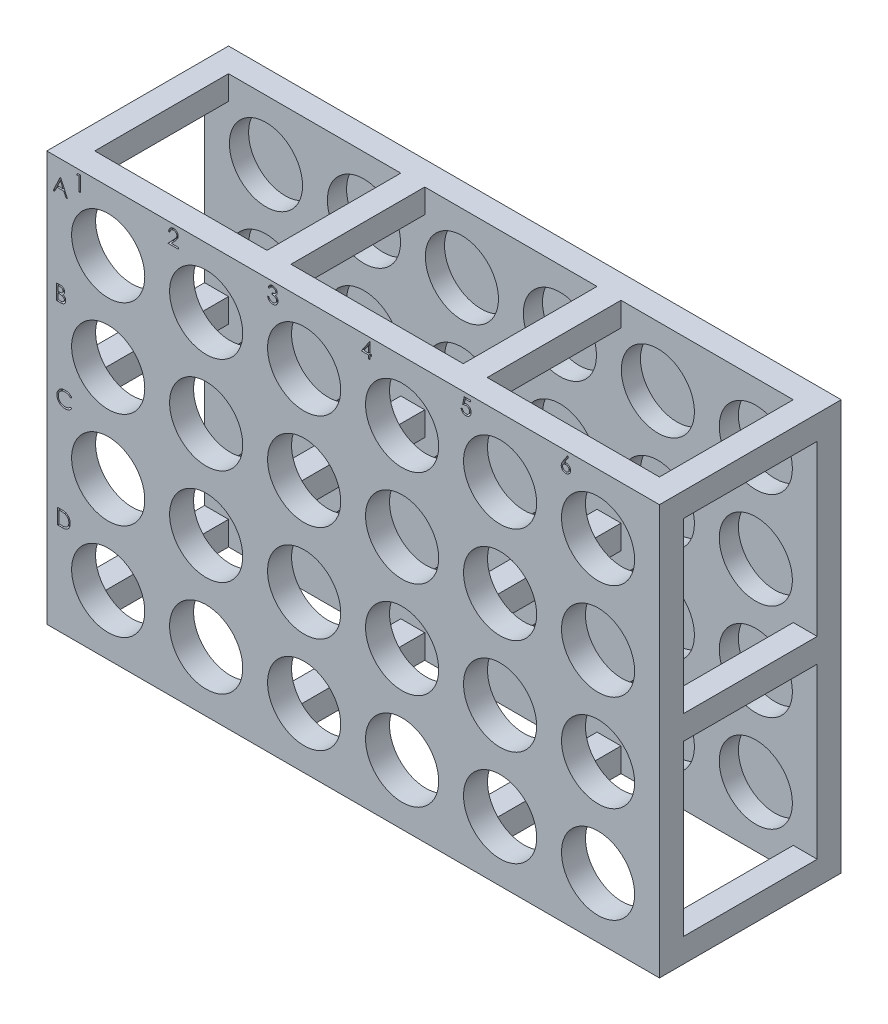
from build123d import *

# Parameters (mm, degrees)
SKETCH1_W            = 127.76
SKETCH1_H            = 85.48
BOSS_EXTRUDE1_DEPTH  = 5
SKETCH2_R            = 7.625
CUT_EXTRUDE1_DEPTH   = 95.825210988
SKETCH3_W            = 5
SKETCH3_H            = 5
BOSS_EXTRUDE2_DEPTH  = 13.95
LPATTERN2_COUNT      = 6
LPATTERN2_PITCH      = 20.43
LPATTERN2_COUNT_DIR2 = 4
LPATTERN2_PITCH_DIR2 = 20.146
LPATTERN5_COUNT      = 4
LPATTERN5_PITCH      = 40.92
LPATTERN5_COUNT_DIR2 = 3
LPATTERN5_PITCH_DIR2 = 40.24
CUT_EXTRUDE2_DEPTH   = 1
SKETCH6_W            = 127.76
SKETCH6_H            = 85.48
BOSS_EXTRUDE3_DEPTH  = 1


with BuildPart() as part:
    # Sketch1 → Boss-Extrude1 (new body)
    with BuildSketch(Plane.XY):
        with Locations((9.206235294, -17.469823529)):
            Rectangle(SKETCH1_W, SKETCH1_H)
    extrude(amount=BOSS_EXTRUDE1_DEPTH)

    # Sketch2 → Cut-Extrude1 (cut, through all)
    with BuildSketch(Plane.XY.offset(5)):
        with Locations((-41.868764706, 12.749176471)):
            Circle(SKETCH2_R)
    cut_extrude1 = extrude(amount=-CUT_EXTRUDE1_DEPTH, mode=Mode.SUBTRACT)

    # Sketch3 → Boss-Extrude2 (add)
    with BuildSketch(Plane.XY.offset(5)):
        with Locations((-52.173764706, 22.770176471)):
            Rectangle(SKETCH3_W, SKETCH3_H)
    boss_extrude2 = extrude(amount=BOSS_EXTRUDE2_DEPTH)

    # LPattern2: Cut-Extrude1 6 × 4
    with Locations(*[(i * LPATTERN2_PITCH, -j * LPATTERN2_PITCH_DIR2, 0) for i in range(LPATTERN2_COUNT) for j in range(LPATTERN2_COUNT_DIR2) if (i, j) != (0, 0)]):
        add(cut_extrude1, mode=Mode.SUBTRACT)

    # LPattern5: Boss-Extrude2 4 × 3
    with Locations(*[(i * LPATTERN5_PITCH, -j * LPATTERN5_PITCH_DIR2, 0) for i in range(LPATTERN5_COUNT) for j in range(LPATTERN5_COUNT_DIR2) if (i, j) != (0, 0)]):
        add(boss_extrude2)

    # Mirror9: part across plane


with BuildPart() as part_1:
    add(part.part)
    add(part.part.mirror(Plane(origin=(0, 0, 18.95), x_dir=(1, 0, 0), z_dir=(0, 0, -1))))

    # Sketch5 → Cut-Extrude2 (cut)
    # profile 1 of 10: a face of its own
    with BuildSketch(Plane.XY.offset(37.9)):
        Polygon((-51.807746166, 21.94980685), (-50.342361551, 18.77480685), (-50.652102136, 18.77480685), (-51.121483145, 19.792435055), (-52.560791038, 19.792435055), (-53.043528418, 18.77480685), (-53.354541038, 18.77480685), (-51.848451294, 21.94980685), align=None)
        Polygon((-51.831278818, 21.330961697), (-52.406238754, 20.11807608), (-51.271583306, 20.11807608), align=None, mode=Mode.SUBTRACT)
    # profile 2 of 10: a face of its own
    with BuildSketch(Plane.XY.offset(37.9)):
        with BuildLine():
            Line((-52.596136472, 2.460659233), (-51.976655302, 2.460659233))
            add(Edge.make_bspline(
                [(-51.976655302, 2.460659233), (-51.946330897, 2.460499802), (-51.887554653, 2.460190786), (-51.802084159, 2.455398231), (-51.722029881, 2.448863473), (-51.647368602, 2.438494746), (-51.578134822, 2.425983634), (-51.514119894, 2.410832701), (-51.45552738, 2.392665702), (-51.385575112, 2.363776575), (-51.305818513, 2.320847701), (-51.219459971, 2.257412503), (-51.145614696, 2.17982234), (-51.08194568, 2.092298788), (-51.031326093, 1.996018481), (-50.994705373, 1.893276216), (-50.971520729, 1.785397208), (-50.969136364, 1.711335182), (-50.967931344, 1.673905427)],
                knots=[0, 0, 0, 0, 1.001505555, 1.941167018, 2.826882275, 3.653841531, 4.429895133, 5.150066043, 5.825578002, 6.45369114, 7.647487171, 8.808567382, 9.977351308, 11.170798116, 12.373658725, 13.556498008, 14.765093433, 16, 16, 16, 16], degree=3))
            add(Edge.make_bspline(
                [(-50.967931344, 1.673905427), (-50.968923049, 1.638842037), (-50.970871844, 1.569939169), (-50.989507061, 1.469160942), (-51.018681382, 1.373229479), (-51.059235429, 1.282494886), (-51.11194224, 1.199007252), (-51.174406572, 1.122093089), (-51.2497691, 1.055008916), (-51.306232611, 1.017504997), (-51.334913516, 0.998454706)],
                knots=[0, 0, 0, 0, 1.044552857, 2.05264487, 3.044412934, 4.028983338, 5.005914585, 5.980388656, 6.974128949, 8, 8, 8, 8], degree=3))
            add(Edge.make_bspline(
                [(-51.334913516, 0.998454706), (-51.298845128, 0.984607171), (-51.229837367, 0.958113407), (-51.134872198, 0.911272664), (-51.053052589, 0.860325607), (-50.983749464, 0.804688857), (-50.924478877, 0.744718722), (-50.872723708, 0.679535868), (-50.828562747, 0.608289995), (-50.790723167, 0.531723931), (-50.761196795, 0.450619491), (-50.739084368, 0.36573743), (-50.726413896, 0.277382119), (-50.724610821, 0.217251811), (-50.723700575, 0.186896212)],
                knots=[0, 0, 0, 0, 1.27268992, 2.434971085, 3.483601985, 4.442670788, 5.356604649, 6.2567628, 7.179492994, 8.113709626, 9.066344395, 10.018646069, 10.999752585, 12, 12, 12, 12], degree=3))
            add(Edge.make_bspline(
                [(-50.723700575, 0.186896212), (-50.724586714, 0.155901978), (-50.726330217, 0.094919954), (-50.739193477, 0.005334939), (-50.760973167, -0.080276619), (-50.790973421, -0.162468464), (-50.830127806, -0.241081586), (-50.877778174, -0.316205047), (-50.93459395, -0.387084046), (-50.998150981, -0.45450619), (-51.07005307, -0.51512854), (-51.147628076, -0.569117788), (-51.231852952, -0.613518859), (-51.321344404, -0.650816964), (-51.417106319, -0.67930778), (-51.518708684, -0.699240043), (-51.626063872, -0.712670327), (-51.699732718, -0.713774506), (-51.737512674, -0.714340767)],
                knots=[0, 0, 0, 0, 0.978564426, 1.925352924, 2.850884081, 3.763762016, 4.682927383, 5.618979971, 6.567305752, 7.547517671, 8.540179244, 9.531824382, 10.526200242, 11.540722885, 12.589160233, 13.674978461, 14.80764778, 16, 16, 16, 16], degree=3))
            Line((-51.737512674, -0.714340767), (-52.596136472, -0.714340767))
            Line((-52.596136472, -0.714340767), (-52.596136472, 2.460659233))
        make_face()
        with BuildLine():
            Line((-52.311200575, 2.135018207), (-52.311200575, 1.117390002))
            Line((-52.311200575, 1.117390002), (-52.119759269, 1.117390002))
            add(Edge.make_bspline(
                [(-52.119759269, 1.117390002), (-52.091775004, 1.117752789), (-52.037703703, 1.118453768), (-51.959399225, 1.120461745), (-51.886714387, 1.126084255), (-51.819774653, 1.13170515), (-51.758685436, 1.14084424), (-51.703582076, 1.151722809), (-51.653599777, 1.163228016), (-51.595960332, 1.182794622), (-51.530579872, 1.211712227), (-51.46088127, 1.25659025), (-51.39943643, 1.310043056), (-51.34755041, 1.371720571), (-51.305085719, 1.439634897), (-51.275591134, 1.512702424), (-51.255591098, 1.589102116), (-51.253784494, 1.641551531), (-51.252867241, 1.668181268)],
                knots=[0, 0, 0, 0, 1.156816544, 2.235205308, 3.236616184, 4.169592532, 5.011045266, 5.787822928, 6.49130361, 7.128639758, 8.301311294, 9.436451833, 10.541879658, 11.654887649, 12.756523258, 13.837046038, 14.901820046, 16, 16, 16, 16], degree=3))
            add(Edge.make_bspline(
                [(-51.252867241, 1.668181268), (-51.253344562, 1.685803218), (-51.254280879, 1.720370597), (-51.261949232, 1.770761797), (-51.274982674, 1.818154344), (-51.291723354, 1.863197715), (-51.315117379, 1.904483465), (-51.342661378, 1.943439078), (-51.37594054, 1.978737929), (-51.413820388, 2.011730259), (-51.457371067, 2.040980652), (-51.506566596, 2.066599059), (-51.56207256, 2.087228192), (-51.622953507, 2.105294988), (-51.690146565, 2.117984368), (-51.762876339, 2.128555656), (-51.841738548, 2.1339375), (-51.896298748, 2.134649937), (-51.924501857, 2.135018207)],
                knots=[0, 0, 0, 0, 0.91205012, 1.789085906, 2.630437955, 3.453916878, 4.269457761, 5.079663411, 5.91843418, 6.774407191, 7.675494373, 8.627863946, 9.638891023, 10.736472738, 11.911756761, 13.175263542, 14.539845004, 16, 16, 16, 16], degree=3))
            Line((-51.924501857, 2.135018207), (-52.311200575, 2.135018207))
        make_face(mode=Mode.SUBTRACT)
        with BuildLine():
            Line((-52.311200575, 0.791748976), (-52.311200575, -0.388699742))
            Line((-52.311200575, -0.388699742), (-51.905421328, -0.388699742))
            add(Edge.make_bspline(
                [(-51.905421328, -0.388699742), (-51.876375588, -0.388351628), (-51.820393754, -0.387680685), (-51.739566209, -0.385490339), (-51.664651536, -0.38050806), (-51.595991585, -0.372665039), (-51.53284496, -0.364157446), (-51.475969186, -0.352717213), (-51.424903218, -0.339609941), (-51.365690096, -0.319349656), (-51.299011913, -0.287875001), (-51.227156351, -0.240418524), (-51.16326971, -0.18388238), (-51.109017796, -0.118449337), (-51.064556014, -0.047300919), (-51.032211422, 0.028123791), (-51.012262574, 0.10657852), (-51.009847606, 0.160069752), (-51.008636472, 0.186896212)],
                knots=[0, 0, 0, 0, 1.160039823, 2.235823828, 3.228722157, 4.157150951, 4.99529583, 5.772374946, 6.472645482, 7.099169577, 8.269452708, 9.405989375, 10.527446681, 11.663510218, 12.788923519, 13.866172445, 14.929861265, 16, 16, 16, 16], degree=3))
            add(Edge.make_bspline(
                [(-51.008636472, 0.186896212), (-51.008886938, 0.203672314), (-51.00938383, 0.236953917), (-51.016877388, 0.285863267), (-51.027775684, 0.333239595), (-51.041864914, 0.379211546), (-51.062384002, 0.422947966), (-51.08633851, 0.465313859), (-51.114424925, 0.50636523), (-51.158189275, 0.558264917), (-51.22184529, 0.618061064), (-51.312293579, 0.676605798), (-51.415138449, 0.723820595), (-51.489730532, 0.743867977), (-51.528262874, 0.754223936)],
                knots=[0, 0, 0, 0, 0.723448775, 1.435228256, 2.130040452, 2.821711965, 3.505591119, 4.210454504, 4.921174351, 5.648778258, 7.137944449, 8.670945889, 10.280296675, 12, 12, 12, 12], degree=3))
            add(Edge.make_bspline(
                [(-51.528262874, 0.754223936), (-51.543710697, 0.757358191), (-51.577204763, 0.764153902), (-51.63182164, 0.771327318), (-51.694174892, 0.777718194), (-51.764408502, 0.782445459), (-51.842611329, 0.787331823), (-51.928950391, 0.789232125), (-52.023073098, 0.791499311), (-52.088380465, 0.791663626), (-52.122303339, 0.791748976)],
                knots=[0, 0, 0, 0, 0.634451884, 1.375622551, 2.216452059, 3.157844607, 4.20941857, 5.370758133, 6.634282058, 8, 8, 8, 8], degree=3))
            Line((-52.122303339, 0.791748976), (-52.311200575, 0.791748976))
        make_face(mode=Mode.SUBTRACT)
    # profile 3 of 10: a face of its own
    with BuildSketch(Plane.XY.offset(37.9)):
        with BuildLine():
            Line((-49.467090618, -16.692223676), (-49.716409528, -16.883028964))
            add(Edge.make_bspline(
                [(-49.716409528, -16.883028964), (-49.73419487, -16.861832691), (-49.769525768, -16.819725918), (-49.826366616, -16.76059876), (-49.885604535, -16.705203844), (-49.947216881, -16.653277282), (-50.012312653, -16.60663493), (-50.079314949, -16.562846144), (-50.149344605, -16.523596124), (-50.246183678, -16.476004701), (-50.372864226, -16.426342118), (-50.532335259, -16.384701329), (-50.698806041, -16.358193548), (-50.812378149, -16.355322585), (-50.870145506, -16.353862297)],
                knots=[0, 0, 0, 0, 0.757959112, 1.505699292, 2.245454638, 2.979532153, 3.711538275, 4.438200793, 5.171680507, 5.909471876, 7.393775596, 8.890124382, 10.418191784, 12, 12, 12, 12], degree=3))
            add(Edge.make_bspline(
                [(-50.870145506, -16.353862297), (-50.90197107, -16.354228749), (-50.965326828, -16.354958251), (-51.0593508, -16.364582244), (-51.151619068, -16.378108841), (-51.242071612, -16.39817967), (-51.330593296, -16.423554832), (-51.417762832, -16.453876457), (-51.502318162, -16.491391205), (-51.585428993, -16.532855126), (-51.665057277, -16.579688594), (-51.74040007, -16.630772849), (-51.811182584, -16.685536244), (-51.877460811, -16.744184033), (-51.939302507, -16.806452097), (-51.996259567, -16.873004036), (-52.048134904, -16.943627079), (-52.095956776, -17.017389956), (-52.13878547, -17.094077809), (-52.174644718, -17.17397448), (-52.206399365, -17.255711774), (-52.231526535, -17.340213184), (-52.251415203, -17.426884122), (-52.265138155, -17.515957194), (-52.274652697, -17.607246317), (-52.275378572, -17.669121908), (-52.275744464, -17.700311616)],
                knots=[0, 0, 0, 0, 1.054917814, 2.100044995, 3.131103042, 4.146048494, 5.169673617, 6.183595914, 7.203665975, 8.234915748, 9.262203917, 10.264457458, 11.251630812, 12.227803204, 13.197192746, 14.159520551, 15.12972552, 16.100847026, 17.073214652, 18.039054194, 19.002613845, 19.979014051, 20.95965708, 21.949030935, 22.966165397, 24, 24, 24, 24], degree=3))
            add(Edge.make_bspline(
                [(-52.275744464, -17.700311616), (-52.274599814, -17.747239314), (-52.272352445, -17.839375623), (-52.252351457, -17.974331819), (-52.221957552, -18.103618431), (-52.176404851, -18.226427288), (-52.120235426, -18.344272727), (-52.049260014, -18.455160829), (-51.96705787, -18.560767284), (-51.872466075, -18.658596244), (-51.768683656, -18.747962266), (-51.657333765, -18.826657437), (-51.538693732, -18.892257366), (-51.414073503, -18.946845546), (-51.2825141, -18.988807006), (-51.144252101, -19.018347318), (-50.999588219, -19.03761701), (-50.900737407, -19.039461856), (-50.850428959, -19.040400759)],
                knots=[0, 0, 0, 0, 1.029171465, 2.020641659, 2.987623507, 3.938342917, 4.889210282, 5.84687017, 6.821220943, 7.821438502, 8.827599549, 9.822697543, 10.807740252, 11.797342354, 12.80366471, 13.83203677, 14.896651826, 16, 16, 16, 16], degree=3))
            add(Edge.make_bspline(
                [(-50.850428959, -19.040400759), (-50.795000092, -19.038868794), (-50.68590282, -19.035853522), (-50.525911825, -19.01030906), (-50.372753666, -18.968890806), (-50.226420105, -18.910926262), (-50.087323676, -18.83557418), (-49.955246706, -18.744226819), (-49.83007771, -18.63601526), (-49.754810904, -18.553389851), (-49.716409528, -18.511234092)],
                knots=[0, 0, 0, 0, 1.028121516, 2.023589091, 2.998037872, 3.967518031, 4.937445131, 5.927275754, 6.942489185, 8, 8, 8, 8], degree=3))
            Line((-49.716409528, -18.511234092), (-49.467090618, -18.700131328))
            add(Edge.make_bspline(
                [(-49.467090618, -18.700131328), (-49.487154903, -18.726019781), (-49.527187367, -18.777672682), (-49.592009997, -18.85049059), (-49.66029726, -18.918983537), (-49.732556368, -18.982599307), (-49.807956079, -19.042610858), (-49.887850248, -19.097313234), (-49.971188585, -19.147469964), (-50.057688719, -19.193395817), (-50.147258747, -19.234142177), (-50.239791341, -19.269025238), (-50.334887649, -19.299074245), (-50.432552017, -19.323795645), (-50.532987025, -19.343091556), (-50.635830241, -19.355990833), (-50.741303628, -19.364828141), (-50.812461203, -19.365633608), (-50.848520907, -19.366041785)],
                knots=[0, 0, 0, 0, 0.986787822, 1.968848986, 2.935600012, 3.899624008, 4.868462664, 5.837806735, 6.815139263, 7.798259679, 8.787526145, 9.778297419, 10.776456485, 11.791383307, 12.812564526, 13.85620153, 14.913611965, 16, 16, 16, 16], degree=3))
            add(Edge.make_bspline(
                [(-50.848520907, -19.366041785), (-50.88266909, -19.36580412), (-50.950192895, -19.365334167), (-51.049886762, -19.357721273), (-51.146941596, -19.347334726), (-51.241080007, -19.331695464), (-51.332815713, -19.313240241), (-51.4213171, -19.288501315), (-51.507455041, -19.260788857), (-51.590883464, -19.228217905), (-51.671673335, -19.191463939), (-51.749564078, -19.149924454), (-51.82451987, -19.103948762), (-51.897277645, -19.054550288), (-51.966762596, -19.000142307), (-52.033576865, -18.941480432), (-52.098095112, -18.878762379), (-52.138011833, -18.833536905), (-52.158081203, -18.810798395)],
                knots=[0, 0, 0, 0, 1.114604814, 2.203992996, 3.262667896, 4.300477797, 5.318619304, 6.316056647, 7.298880507, 8.271930387, 9.238335007, 10.195173496, 11.151986948, 12.108099108, 13.064862484, 14.031167946, 15.010108607, 16, 16, 16, 16], degree=3))
            add(Edge.make_bspline(
                [(-52.158081203, -18.810798395), (-52.190226394, -18.771300317), (-52.254128691, -18.692781015), (-52.335885561, -18.565521589), (-52.405869414, -18.432654), (-52.462453285, -18.293480207), (-52.506688051, -18.148312506), (-52.53733242, -17.997077718), (-52.557245662, -17.839917084), (-52.559522852, -17.733022283), (-52.560680362, -17.678687017)],
                knots=[0, 0, 0, 0, 0.994628077, 1.977248131, 2.950237994, 3.925870899, 4.908910175, 5.911660606, 6.938484602, 8, 8, 8, 8], degree=3))
            add(Edge.make_bspline(
                [(-52.560680362, -17.678687017), (-52.559269579, -17.621577427), (-52.556493952, -17.509217874), (-52.532912052, -17.344322931), (-52.49497643, -17.186342733), (-52.441094966, -17.035572193), (-52.372782255, -16.891218296), (-52.288393827, -16.754383775), (-52.188910062, -16.624193535), (-52.075111197, -16.502623011), (-51.950317971, -16.391462312), (-51.816678762, -16.293666684), (-51.674455138, -16.212280081), (-51.525213944, -16.144247848), (-51.367837647, -16.091956085), (-51.20266202, -16.05534998), (-51.029997433, -16.032565167), (-50.912193661, -16.0296848), (-50.852337012, -16.028221272)],
                knots=[0, 0, 0, 0, 1.032925535, 2.032216505, 3.007276963, 3.968222605, 4.92396291, 5.891752235, 6.871517503, 7.883894988, 8.900124299, 9.891468569, 10.874487609, 11.85992873, 12.854644235, 13.869047385, 14.917252991, 16, 16, 16, 16], degree=3))
            add(Edge.make_bspline(
                [(-50.852337012, -16.028221272), (-50.815856741, -16.02865864), (-50.743647719, -16.029524366), (-50.636829241, -16.037966367), (-50.532832273, -16.052039424), (-50.431585168, -16.071194716), (-50.332595366, -16.0949685), (-50.236619433, -16.125938628), (-50.143094196, -16.161350338), (-50.052609501, -16.20213409), (-49.965599487, -16.247914634), (-49.882091256, -16.298184521), (-49.802748134, -16.35288143), (-49.727011821, -16.411540168), (-49.656149258, -16.475401718), (-49.588148489, -16.542709537), (-49.525318796, -16.615402363), (-49.486535541, -16.666569696), (-49.467090618, -16.692223676)],
                knots=[0, 0, 0, 0, 1.096760587, 2.17092713, 3.219439832, 4.250915756, 5.268269357, 6.278326846, 7.281116186, 8.274029601, 9.260640565, 10.235837813, 11.203064059, 12.156899882, 13.114053108, 14.069676657, 15.032185724, 16, 16, 16, 16], degree=3))
        make_face()
    # profile 4 of 10: a face of its own
    with BuildSketch(Plane.XY.offset(37.9)):
        with BuildLine():
            Line((-52.397859849, -41.14055261), (-52.397859849, -37.96555261))
            Line((-52.397859849, -37.96555261), (-51.75675408, -37.96555261))
            add(Edge.make_bspline(
                [(-51.75675408, -37.96555261), (-51.700992926, -37.965954084), (-51.593262668, -37.96672973), (-51.437585662, -37.971647706), (-51.293546106, -37.980347629), (-51.161617726, -37.993019985), (-51.041438341, -38.008580237), (-50.933344461, -38.028084175), (-50.83677716, -38.051114872), (-50.777387025, -38.070750388), (-50.749302157, -38.080035783)],
                knots=[0, 0, 0, 0, 1.314313732, 2.53924729, 3.670748893, 4.714932338, 5.66265055, 6.526160246, 7.303039223, 8, 8, 8, 8], degree=3))
            add(Edge.make_bspline(
                [(-50.749302157, -38.080035783), (-50.712567643, -38.094033637), (-50.639931633, -38.121711921), (-50.536510886, -38.173923709), (-50.43915145, -38.233081308), (-50.347331225, -38.299262698), (-50.263147619, -38.374341786), (-50.183311884, -38.455129285), (-50.111089956, -38.544562993), (-50.044951716, -38.640788161), (-49.985320082, -38.742671237), (-49.933486703, -38.850018085), (-49.890439152, -38.962283553), (-49.854703868, -39.079155437), (-49.826540295, -39.200890723), (-49.807325257, -39.327631158), (-49.794651574, -39.458875852), (-49.793377899, -39.547934115), (-49.792731644, -39.59312172)],
                knots=[0, 0, 0, 0, 0.984719456, 1.947108742, 2.898477687, 3.838006223, 4.779231079, 5.722358779, 6.681677486, 7.655904652, 8.64651281, 9.637519902, 10.640069247, 11.656948941, 12.698408672, 13.768548281, 14.867775369, 16, 16, 16, 16], degree=3))
            add(Edge.make_bspline(
                [(-49.792731644, -39.59312172), (-49.793302207, -39.632365844), (-49.794426562, -39.709700488), (-49.804522441, -39.823674729), (-49.819196674, -39.934267755), (-49.84191534, -40.040952925), (-49.869494762, -40.144664952), (-49.904840814, -40.244298487), (-49.945331586, -40.340767515), (-49.992548261, -40.432767653), (-50.04438366, -40.519928998), (-50.100011242, -40.602093942), (-50.159371672, -40.678090036), (-50.223030997, -40.748147419), (-50.290166568, -40.81216048), (-50.361217925, -40.870663951), (-50.436368407, -40.922513111), (-50.51528142, -40.969745417), (-50.600259051, -41.010948168), (-50.692910872, -41.045809677), (-50.793632013, -41.074699106), (-50.902175245, -41.098802705), (-51.018728114, -41.117922829), (-51.14340489, -41.130737485), (-51.276014017, -41.13940336), (-51.367072351, -41.140162088), (-51.413940578, -41.14055261)],
                knots=[0, 0, 0, 0, 1.105936401, 2.179363191, 3.223086493, 4.248585256, 5.251745608, 6.245858792, 7.225916811, 8.198733463, 9.158002045, 10.082870192, 10.993790845, 11.873723703, 12.748670949, 13.606408763, 14.465103618, 15.319838547, 16.196477973, 17.123216899, 18.106603292, 19.147568657, 20.255746949, 21.433717677, 22.679120308, 24, 24, 24, 24], degree=3))
            Line((-51.413940578, -41.14055261), (-52.397859849, -41.14055261))
        make_face()
        with BuildLine():
            Line((-52.112923951, -40.814911584), (-51.74848585, -40.814911584))
            add(Edge.make_bspline(
                [(-51.74848585, -40.814911584), (-51.696117971, -40.814686525), (-51.595395361, -40.814253655), (-51.450562749, -40.810455263), (-51.318229297, -40.804248649), (-51.198376213, -40.795562685), (-51.09107117, -40.784070441), (-50.996089911, -40.771257137), (-50.913743784, -40.755293735), (-50.863914938, -40.740823936), (-50.840888695, -40.734137345)],
                knots=[0, 0, 0, 0, 1.375205317, 2.645023457, 3.804390687, 4.853969522, 5.800190428, 6.637939096, 7.370582563, 8, 8, 8, 8], degree=3))
            add(Edge.make_bspline(
                [(-50.840888695, -40.734137345), (-50.811906967, -40.723930575), (-50.754635738, -40.703760822), (-50.67219361, -40.666969229), (-50.595306899, -40.623388209), (-50.522635662, -40.574944717), (-50.455210767, -40.51993013), (-50.392233176, -40.459540733), (-50.333829685, -40.393469187), (-50.280603705, -40.321797497), (-50.232971172, -40.244971754), (-50.191722271, -40.163747241), (-50.155571239, -40.07901392), (-50.127197087, -39.989470612), (-50.10495795, -39.895917823), (-50.089205698, -39.798348973), (-50.079395198, -39.696782281), (-50.078250884, -39.627701426), (-50.077667541, -39.592485703)],
                knots=[0, 0, 0, 0, 0.998632004, 1.973411704, 2.929992603, 3.868527914, 4.809262121, 5.754881198, 6.702106254, 7.672490631, 8.653608572, 9.636854334, 10.631411391, 11.644891563, 12.686317036, 13.754757253, 14.855430412, 16, 16, 16, 16], degree=3))
            add(Edge.make_bspline(
                [(-50.077667541, -39.592485703), (-50.078133166, -39.555353188), (-50.079047891, -39.482406036), (-50.090545301, -39.375371619), (-50.107346997, -39.272428458), (-50.131643627, -39.173569666), (-50.16260521, -39.078602375), (-50.201244635, -38.988051819), (-50.245392211, -38.900961688), (-50.297918809, -38.819342085), (-50.355445812, -38.742150479), (-50.419288602, -38.671434234), (-50.48843288, -38.607032262), (-50.562124494, -38.5479416), (-50.642440291, -38.496539551), (-50.727488282, -38.45055949), (-50.818516141, -38.411537931), (-50.881846229, -38.390783535), (-50.914030722, -38.380236103)],
                knots=[0, 0, 0, 0, 1.122418816, 2.205001699, 3.251619955, 4.274784885, 5.280384055, 6.268708349, 7.249350384, 8.229342522, 9.199999885, 10.157847722, 11.105861043, 12.055065948, 13.010012805, 13.98527497, 14.976112212, 16, 16, 16, 16], degree=3))
            add(Edge.make_bspline(
                [(-50.914030722, -38.380236103), (-50.940656405, -38.372873344), (-50.997269912, -38.357218097), (-51.089652854, -38.340140795), (-51.193625168, -38.325078142), (-51.309648469, -38.312325492), (-51.437590499, -38.30317485), (-51.577549659, -38.296306586), (-51.729586443, -38.291674141), (-51.834980599, -38.291357814), (-51.889681764, -38.291193635)],
                knots=[0, 0, 0, 0, 0.674548936, 1.434276114, 2.292660221, 3.240891867, 4.284742987, 5.42552168, 6.663806718, 8, 8, 8, 8], degree=3))
            Line((-51.889681764, -38.291193635), (-52.112923951, -38.291193635))
            Line((-52.112923951, -38.291193635), (-52.112923951, -40.814911584))
        make_face(mode=Mode.SUBTRACT)
    # profile 5 of 10: a face of its own
    with BuildSketch(Plane.XY.offset(37.9)):
        Polygon((-48.244709863, 24.417904253), (-47.657665592, 24.417904253), (-47.657665592, 21.242904253), (-47.94260149, 21.242904253), (-47.94260149, 24.092263227), (-48.431063028, 24.092263227), align=None)
    # profile 6 of 10: a face of its own
    with BuildSketch(Plane.XY.offset(37.9)):
        with BuildLine():
            Line((-28.974011746, 23.440981176), (-29.258947644, 23.440981176))
            add(Edge.make_bspline(
                [(-29.258947644, 23.440981176), (-29.257090583, 23.478782624), (-29.253443367, 23.553023662), (-29.236363418, 23.661267491), (-29.211924194, 23.764731487), (-29.177369804, 23.862584909), (-29.134456252, 23.95569297), (-29.082994013, 24.043685842), (-29.022039591, 24.126227848), (-28.952909197, 24.202553799), (-28.877826217, 24.272573953), (-28.796812972, 24.33303978), (-28.711682126, 24.384127953), (-28.622691956, 24.426837366), (-28.528838445, 24.458895654), (-28.430973281, 24.482682427), (-28.328666493, 24.496993827), (-28.258961616, 24.498532147), (-28.223510945, 24.499314509)],
                knots=[0, 0, 0, 0, 1.10065271, 2.161652631, 3.183658789, 4.190468796, 5.17591951, 6.163126047, 7.15150782, 8.156236427, 9.156009102, 10.134482811, 11.092018607, 12.041330605, 13.001268258, 13.972401359, 14.968799086, 16, 16, 16, 16], degree=3))
            add(Edge.make_bspline(
                [(-28.223510945, 24.499314509), (-28.188696549, 24.498499481), (-28.120287505, 24.496897979), (-28.020445535, 24.48314476), (-27.925397561, 24.461604116), (-27.835329372, 24.431382274), (-27.750959585, 24.3907564), (-27.671654395, 24.341954347), (-27.596469659, 24.285512072), (-27.528790648, 24.219060398), (-27.466644034, 24.148119664), (-27.413029845, 24.072384208), (-27.367116475, 23.994161928), (-27.328846223, 23.912856345), (-27.300673868, 23.827701912), (-27.279285065, 23.739938378), (-27.267195197, 23.648657299), (-27.265339706, 23.586874924), (-27.264396362, 23.555464349)],
                knots=[0, 0, 0, 0, 1.111607364, 2.184268762, 3.212621178, 4.221274766, 5.211760367, 6.196651075, 7.1921475, 8.207485113, 9.220403448, 10.201281604, 11.166441695, 12.114753415, 13.065576456, 14.026450734, 14.996634279, 16, 16, 16, 16], degree=3))
            add(Edge.make_bspline(
                [(-27.264396362, 23.555464349), (-27.265932393, 23.511243099), (-27.2689775, 23.423576619), (-27.295025542, 23.294748851), (-27.335707734, 23.169931964), (-27.384691051, 23.069477411), (-27.434105339, 22.988529884), (-27.478634721, 22.921883274), (-27.530763514, 22.850123313), (-27.591250437, 22.7734903), (-27.658844257, 22.691383979), (-27.734157219, 22.60385395), (-27.817726378, 22.511804559), (-27.876380875, 22.448934478), (-27.906774166, 22.416356777)],
                knots=[0, 0, 0, 0, 1.184426356, 2.348067706, 3.509069118, 4.696110526, 5.333549288, 6.050745305, 6.844228056, 7.710549037, 8.667450064, 9.695053472, 10.805634456, 12, 12, 12, 12], degree=3))
            Line((-27.906774166, 22.416356777), (-28.701160184, 21.568545278))
            Line((-28.701160184, 21.568545278), (-27.223691233, 21.568545278))
            Line((-27.223691233, 21.568545278), (-27.223691233, 21.242904253))
            Line((-27.223691233, 21.242904253), (-29.381063028, 21.242904253))
            Line((-29.381063028, 21.242904253), (-28.1497329, 22.556916672))
            add(Edge.make_bspline(
                [(-28.1497329, 22.556916672), (-28.119753746, 22.588211565), (-28.062169925, 22.648322648), (-27.980724302, 22.736082334), (-27.90757322, 22.817497988), (-27.842243156, 22.892415786), (-27.786151334, 22.961931565), (-27.73637438, 23.023793904), (-27.696491308, 23.080721155), (-27.653206628, 23.146707283), (-27.611283945, 23.227272742), (-27.575259165, 23.325728303), (-27.553292838, 23.427080883), (-27.550657737, 23.495572016), (-27.549332259, 23.530023644)],
                knots=[0, 0, 0, 0, 1.329631726, 2.553950428, 3.673215718, 4.687767853, 5.603093632, 6.413772471, 7.123043292, 7.734684054, 8.834405432, 9.900288307, 10.943827018, 12, 12, 12, 12], degree=3))
            add(Edge.make_bspline(
                [(-27.549332259, 23.530023644), (-27.549908968, 23.551687484), (-27.551045551, 23.594382752), (-27.561076462, 23.656980833), (-27.576235278, 23.717364629), (-27.597957048, 23.775719876), (-27.626628877, 23.831459861), (-27.661529729, 23.884652432), (-27.701797858, 23.936077422), (-27.748380795, 23.984295056), (-27.799554102, 24.028455864), (-27.8536146, 24.06757557), (-27.910810052, 24.100268192), (-27.970899305, 24.127068365), (-28.033714838, 24.148091746), (-28.099378143, 24.162659172), (-28.167707786, 24.171805425), (-28.214365314, 24.173042924), (-28.23813935, 24.173673483)],
                knots=[0, 0, 0, 0, 0.991446411, 1.95395049, 2.89581595, 3.838931463, 4.798493298, 5.75982156, 6.748411868, 7.785213223, 8.824556874, 9.840280684, 10.836137867, 11.835679398, 12.848801643, 13.863922112, 14.911575587, 16, 16, 16, 16], degree=3))
            add(Edge.make_bspline(
                [(-28.23813935, 24.173673483), (-28.262968606, 24.173024847), (-28.311729164, 24.171751032), (-28.383320001, 24.162840473), (-28.451614956, 24.147468175), (-28.516785825, 24.12644362), (-28.578942878, 24.099720508), (-28.637783832, 24.066435854), (-28.693176596, 24.026717971), (-28.745225299, 23.981686894), (-28.79318048, 23.931551285), (-28.835314432, 23.875662247), (-28.872129931, 23.815040234), (-28.904251164, 23.749848821), (-28.930336683, 23.679496463), (-28.950269469, 23.604232902), (-28.966041823, 23.524384935), (-28.971310981, 23.469244179), (-28.974011746, 23.440981176)],
                knots=[0, 0, 0, 0, 1.031018746, 2.02475058, 2.990194455, 3.934040569, 4.864654155, 5.795059489, 6.735614925, 7.690564532, 8.649604399, 9.611025574, 10.590972636, 11.591080095, 12.624614302, 13.701020113, 14.821632451, 16, 16, 16, 16], degree=3))
        make_face()
    # profile 7 of 10: a face of its own
    with BuildSketch(Plane.XY.offset(37.9)):
        with BuildLine():
            Line((-8.214396362, 23.685211945), (-8.499332259, 23.685211945))
            add(Edge.make_bspline(
                [(-8.499332259, 23.685211945), (-8.491612881, 23.717172841), (-8.476522128, 23.779653779), (-8.445046472, 23.868923223), (-8.410757148, 23.95339956), (-8.369582746, 24.031500998), (-8.324671233, 24.104797146), (-8.273215621, 24.171625566), (-8.217589873, 24.233685899), (-8.156062955, 24.288761478), (-8.091539097, 24.338634133), (-8.023109121, 24.381156506), (-7.952149782, 24.417736273), (-7.87816944, 24.44787177), (-7.800947841, 24.470573495), (-7.721183111, 24.487044311), (-7.638666222, 24.497740536), (-7.582652336, 24.498784443), (-7.554210063, 24.499314509)],
                knots=[0, 0, 0, 0, 1.162005537, 2.271625781, 3.343758855, 4.383309926, 5.390229558, 6.379919256, 7.361854164, 8.333198761, 9.295911338, 10.242430842, 11.177959212, 12.116337295, 13.062827104, 14.020064771, 14.994644689, 16, 16, 16, 16], degree=3))
            add(Edge.make_bspline(
                [(-7.554210063, 24.499314509), (-7.51276929, 24.49806335), (-7.430791688, 24.495588324), (-7.310356638, 24.472987371), (-7.194218023, 24.437223143), (-7.083647063, 24.387807691), (-6.98094177, 24.3268592), (-6.889559658, 24.25431976), (-6.810739366, 24.171588965), (-6.744613752, 24.080210139), (-6.692838574, 23.982551212), (-6.654660221, 23.882039641), (-6.631417696, 23.778913853), (-6.628405477, 23.709284035), (-6.626896362, 23.674399645)],
                knots=[0, 0, 0, 0, 1.083050992, 2.142477498, 3.193116406, 4.255571735, 5.30263384, 6.308962982, 7.297363603, 8.282367274, 9.249857812, 10.179914175, 11.08814088, 12, 12, 12, 12], degree=3))
            add(Edge.make_bspline(
                [(-6.626896362, 23.674399645), (-6.627951905, 23.640829196), (-6.630017439, 23.575137036), (-6.647555872, 23.479232535), (-6.677070911, 23.388843369), (-6.717955624, 23.303589029), (-6.770879744, 23.224010067), (-6.834989977, 23.149927437), (-6.91073882, 23.081012558), (-6.968141856, 23.041534179), (-6.997694639, 23.021209541)],
                knots=[0, 0, 0, 0, 1.024540389, 2.004866551, 2.965041327, 3.920577974, 4.882998113, 5.874504559, 6.905732034, 8, 8, 8, 8], degree=3))
            add(Edge.make_bspline(
                [(-6.997694639, 23.021209541), (-6.963920119, 23.004900771), (-6.897003025, 22.972588381), (-6.805789331, 22.90921923), (-6.722987258, 22.8360524), (-6.676810313, 22.778954422), (-6.653609102, 22.750266031)],
                knots=[0, 0, 0, 0, 1.015518401, 2.012035669, 3.001164323, 4, 4, 4, 4], degree=3))
            add(Edge.make_bspline(
                [(-6.653609102, 22.750266031), (-6.638331599, 22.729349357), (-6.608026771, 22.687858532), (-6.570620251, 22.621150489), (-6.536684841, 22.553703066), (-6.510241427, 22.483708462), (-6.489763705, 22.411977943), (-6.475126019, 22.338388341), (-6.466032691, 22.262879563), (-6.46473044, 22.211796099), (-6.464075849, 22.186118395)],
                knots=[0, 0, 0, 0, 1.025084078, 2.033381695, 3.024893161, 4.013698104, 4.991890475, 5.976764909, 6.982997093, 8, 8, 8, 8], degree=3))
            add(Edge.make_bspline(
                [(-6.464075849, 22.186118395), (-6.465703729, 22.141659577), (-6.468951828, 22.052951164), (-6.497984096, 21.921891952), (-6.542990393, 21.793780246), (-6.606904899, 21.671248071), (-6.684798996, 21.556603011), (-6.777470283, 21.454026645), (-6.883865811, 21.365853625), (-7.002525221, 21.292184347), (-7.131082902, 21.233294517), (-7.268583617, 21.19242098), (-7.413046166, 21.165799966), (-7.512112786, 21.162945306), (-7.562478293, 21.161493996)],
                knots=[0, 0, 0, 0, 0.955779014, 1.907060117, 2.875433937, 3.871313158, 4.872415639, 5.851225146, 6.836215519, 7.83643374, 8.849228613, 9.86973379, 10.916971861, 12, 12, 12, 12], degree=3))
            add(Edge.make_bspline(
                [(-7.562478293, 21.161493996), (-7.596422944, 21.16228159), (-7.663214697, 21.163831311), (-7.761407014, 21.174425471), (-7.855134555, 21.193774832), (-7.944524048, 21.219812831), (-8.029654902, 21.25282534), (-8.110267341, 21.293935873), (-8.186857315, 21.342297021), (-8.258702078, 21.398479633), (-8.325793065, 21.461327706), (-8.386347322, 21.53195695), (-8.441374419, 21.609061738), (-8.489400956, 21.693537653), (-8.532614477, 21.784292994), (-8.568157202, 21.882489846), (-8.59944054, 21.987250352), (-8.613985182, 22.060255159), (-8.621447644, 22.097711945)],
                knots=[0, 0, 0, 0, 1.048658725, 2.063410685, 3.046034179, 4.001477787, 4.936774919, 5.862367409, 6.792675028, 7.730719943, 8.675894397, 9.627829632, 10.600096036, 11.597688215, 12.626045268, 13.701542398, 14.82072376, 16, 16, 16, 16], degree=3))
            Line((-8.621447644, 22.097711945), (-8.336511746, 22.097711945))
            add(Edge.make_bspline(
                [(-8.336511746, 22.097711945), (-8.329088332, 22.07326534), (-8.314649146, 22.02571457), (-8.290070747, 21.957279436), (-8.262068815, 21.894543202), (-8.232029179, 21.837045655), (-8.20048016, 21.784220547), (-8.165178764, 21.737464709), (-8.128739611, 21.69472449), (-8.101271912, 21.670644735), (-8.087828854, 21.658859781)],
                knots=[0, 0, 0, 0, 1.198163088, 2.33053128, 3.407730985, 4.417276592, 5.372219308, 6.28897303, 7.162600585, 8, 8, 8, 8], degree=3))
            add(Edge.make_bspline(
                [(-8.087828854, 21.658859781), (-8.070051959, 21.645154364), (-8.034553044, 21.617785835), (-7.976706148, 21.582859358), (-7.915868716, 21.552596142), (-7.850722547, 21.52947879), (-7.782673434, 21.509904769), (-7.710621467, 21.497095441), (-7.63520232, 21.488306885), (-7.583705849, 21.48753134), (-7.557390152, 21.487135022)],
                knots=[0, 0, 0, 0, 0.946170439, 1.889420265, 2.845303464, 3.807233317, 4.801018734, 5.828864929, 6.890507805, 8, 8, 8, 8], degree=3))
            add(Edge.make_bspline(
                [(-7.557390152, 21.487135022), (-7.527678046, 21.487693736), (-7.469578587, 21.488786253), (-7.384801679, 21.498833501), (-7.304149923, 21.513466091), (-7.228518769, 21.536065725), (-7.156917523, 21.563988355), (-7.090349884, 21.599047979), (-7.027941988, 21.64018212), (-6.97049317, 21.686935499), (-6.918835459, 21.738117856), (-6.873351758, 21.791651142), (-6.834685101, 21.847309644), (-6.803494284, 21.905401368), (-6.778864856, 21.965685754), (-6.762097952, 22.028331978), (-6.750439792, 22.092827355), (-6.749490365, 22.136668634), (-6.749011746, 22.158769637)],
                knots=[0, 0, 0, 0, 1.217147791, 2.380027433, 3.494444702, 4.572153297, 5.609568379, 6.639424714, 7.649109417, 8.668170816, 9.669597737, 10.625200337, 11.543417969, 12.441394052, 13.322311151, 14.205496177, 15.095365482, 16, 16, 16, 16], degree=3))
            add(Edge.make_bspline(
                [(-6.749011746, 22.158769637), (-6.750399948, 22.18835278), (-6.753169445, 22.247371865), (-6.774313656, 22.334201379), (-6.809092483, 22.417861189), (-6.857781118, 22.496923941), (-6.917049958, 22.570199223), (-6.986323838, 22.635578354), (-7.066178016, 22.689526222), (-7.139674612, 22.726799503), (-7.204775861, 22.752233136), (-7.260488388, 22.769173996), (-7.32286045, 22.783519241), (-7.391137781, 22.796865373), (-7.465834841, 22.808224025), (-7.54687031, 22.817696243), (-7.634260608, 22.825275459), (-7.694759023, 22.828660095), (-7.725934823, 22.830404253)],
                knots=[0, 0, 0, 0, 1.07054697, 2.135767047, 3.216561865, 4.33974944, 5.486079747, 6.621378074, 7.775625952, 8.963672916, 9.598146892, 10.304877434, 11.070270905, 11.915000392, 12.823868403, 13.805723172, 14.86925407, 16, 16, 16, 16], degree=3))
            Line((-7.725934823, 22.830404253), (-7.725934823, 23.156045278))
            add(Edge.make_bspline(
                [(-7.725934823, 23.156045278), (-7.68665448, 23.15671185), (-7.609713937, 23.158017501), (-7.497324103, 23.173809053), (-7.389851884, 23.195653623), (-7.289679054, 23.229113762), (-7.198376293, 23.267976031), (-7.11916494, 23.313199107), (-7.053154742, 23.363468201), (-7.000666484, 23.41955921), (-6.961179255, 23.479716432), (-6.932307803, 23.542415114), (-6.915253221, 23.608204798), (-6.912976595, 23.653103533), (-6.911832259, 23.67567168)],
                knots=[0, 0, 0, 0, 1.321986639, 2.589447074, 3.816329219, 5.01088745, 6.139805852, 7.153945165, 8.075214402, 8.924034688, 9.728124013, 10.488707548, 11.240355623, 12, 12, 12, 12], degree=3))
            add(Edge.make_bspline(
                [(-6.911832259, 23.67567168), (-6.912208189, 23.692252206), (-6.912956084, 23.725238376), (-6.9223879, 23.773430403), (-6.936561137, 23.820149118), (-6.95604632, 23.865195846), (-6.982126858, 23.908258166), (-7.013338003, 23.949703209), (-7.050501922, 23.989294351), (-7.093088149, 24.026197213), (-7.138818858, 24.061366449), (-7.188938297, 24.09122382), (-7.241935283, 24.116755412), (-7.297868491, 24.137809746), (-7.356919437, 24.153647815), (-7.418810671, 24.165019614), (-7.483660213, 24.172129486), (-7.527903141, 24.17315312), (-7.550393958, 24.173673483)],
                knots=[0, 0, 0, 0, 0.884392785, 1.759457502, 2.611959086, 3.489218968, 4.37281399, 5.2945488, 6.255912374, 7.266815255, 8.301784654, 9.332968512, 10.37626691, 11.440494194, 12.520033166, 13.637162961, 14.798855837, 16, 16, 16, 16], degree=3))
            add(Edge.make_bspline(
                [(-7.550393958, 24.173673483), (-7.586545114, 24.172411319), (-7.657156729, 24.169946019), (-7.75895169, 24.148353286), (-7.853584228, 24.113901738), (-7.92591859, 24.072778214), (-7.979333497, 24.032183177), (-8.017503291, 23.99672987), (-8.054986897, 23.957330094), (-8.089318332, 23.911557139), (-8.124038297, 23.862510837), (-8.155647292, 23.807697925), (-8.18636287, 23.748548225), (-8.204870897, 23.706732899), (-8.214396362, 23.685211945)],
                knots=[0, 0, 0, 0, 1.472543308, 2.876219568, 4.221790263, 5.565193594, 6.249813518, 6.953379497, 7.687249741, 8.463570142, 9.283606569, 10.136032583, 11.040678096, 12, 12, 12, 12], degree=3))
        make_face()
    # profile 8 of 10: a face of its own
    with BuildSketch(Plane.XY.offset(37.9)):
        Polygon((12.650161932, 24.499314509), (12.708039536, 24.499314509), (12.708039536, 22.301237586), (13.07438569, 22.301237586), (13.07438569, 21.97559656), (12.708039536, 21.97559656), (12.708039536, 21.242904253), (12.423103638, 21.242904253), (12.423103638, 21.97559656), (10.917013895, 21.97559656), align=None)
        Polygon((12.423103638, 22.301237586), (12.423103638, 23.680123804), (11.476709408, 22.301237586), align=None, mode=Mode.SUBTRACT)
    # profile 9 of 10: a face of its own
    with BuildSketch(Plane.XY.offset(37.9)):
        with BuildLine():
            Line((33.671180562, 24.417904253), (33.671180562, 24.092263227))
            Line((33.671180562, 24.092263227), (32.591222629, 24.092263227))
            Line((32.591222629, 24.092263227), (32.420133887, 23.257172081))
            add(Edge.make_bspline(
                [(32.420133887, 23.257172081), (32.453748859, 23.266452399), (32.51887255, 23.284431547), (32.614993281, 23.304393925), (32.70624478, 23.316427578), (32.765458866, 23.318070695), (32.794112252, 23.318865791)],
                knots=[0, 0, 0, 0, 1.100273476, 2.13160584, 3.095893838, 4, 4, 4, 4], degree=3))
            add(Edge.make_bspline(
                [(32.794112252, 23.318865791), (32.829566788, 23.318098406), (32.899279262, 23.316589537), (33.00127745, 23.302100788), (33.098643717, 23.279295294), (33.191174439, 23.247435963), (33.279040795, 23.20669642), (33.361434369, 23.155805759), (33.439591904, 23.096357666), (33.512111258, 23.028008977), (33.577901166, 22.952787224), (33.635746028, 22.871908298), (33.684879235, 22.786158205), (33.724395062, 22.694717653), (33.755949423, 22.598597564), (33.776951589, 22.496786578), (33.790936747, 22.390244355), (33.792499197, 22.317396638), (33.793295946, 22.280249004)],
                knots=[0, 0, 0, 0, 1.052922333, 2.070308379, 3.05430497, 4.020497103, 4.973039431, 5.925935799, 6.892292201, 7.88610001, 8.88166317, 9.857072816, 10.836096531, 11.812156883, 12.81219415, 13.836441305, 14.89672472, 16, 16, 16, 16], degree=3))
            add(Edge.make_bspline(
                [(33.793295946, 22.280249004), (33.792692628, 22.254375276), (33.791494145, 22.20297748), (33.785399426, 22.126646669), (33.773664883, 22.051931813), (33.757909877, 21.978823001), (33.737460683, 21.907458642), (33.712705613, 21.83763447), (33.682410645, 21.769785077), (33.649180755, 21.703268468), (33.611764307, 21.639588394), (33.570236661, 21.580035385), (33.526362251, 21.523716072), (33.47915328, 21.471234472), (33.428170948, 21.422935448), (33.374032693, 21.378532364), (33.317170512, 21.3372743), (33.256704685, 21.300836009), (33.193982575, 21.267305327), (33.128098407, 21.239797547), (33.060551914, 21.215204425), (32.99037092, 21.195601497), (32.91771439, 21.180241251), (32.842462558, 21.169808563), (32.765010093, 21.162209938), (32.712509189, 21.161734271), (32.685989255, 21.161493996)],
                knots=[0, 0, 0, 0, 1.056347294, 2.098418968, 3.122841568, 4.141288669, 5.149314143, 6.15115421, 7.162517403, 8.180376062, 9.185164535, 10.17417709, 11.141909838, 12.097768115, 13.052685741, 14.0056014, 14.954263652, 15.917497458, 16.885230207, 17.854509472, 18.828990115, 19.81800267, 20.826176721, 21.857883937, 22.917946725, 24, 24, 24, 24], degree=3))
            add(Edge.make_bspline(
                [(32.685989255, 21.161493996), (32.654353392, 21.162120685), (32.592113567, 21.163353621), (32.500927052, 21.176251818), (32.413193088, 21.1947248), (32.329617925, 21.222516273), (32.249452565, 21.257339033), (32.173776242, 21.301350132), (32.100655288, 21.351224033), (32.033062226, 21.410079782), (31.970327752, 21.474410436), (31.914169704, 21.54422201), (31.864155674, 21.61836229), (31.821086575, 21.69719133), (31.784349084, 21.780501997), (31.755488345, 21.868606434), (31.732194409, 21.961044294), (31.722339734, 22.02468355), (31.717334408, 22.057006817)],
                knots=[0, 0, 0, 0, 1.0467383, 2.05933395, 3.04377827, 4.011590433, 4.970194871, 5.932262533, 6.905835911, 7.896367577, 8.894135286, 9.877477877, 10.858688626, 11.851381753, 12.8477658, 13.868841284, 14.917554742, 16, 16, 16, 16], degree=3))
            Line((31.717334408, 22.057006817), (32.002270305, 22.057006817))
            add(Edge.make_bspline(
                [(32.002270305, 22.057006817), (32.009281211, 22.026729606), (32.022756561, 21.968535127), (32.052334633, 21.886773124), (32.088498677, 21.813912114), (32.131501193, 21.748988278), (32.182800149, 21.692374402), (32.24133756, 21.641921781), (32.30696728, 21.596405771), (32.379895424, 21.558466547), (32.456833003, 21.526109892), (32.537357544, 21.504563711), (32.619276486, 21.489413616), (32.674683294, 21.48789709), (32.702525714, 21.487135022)],
                knots=[0, 0, 0, 0, 1.136247022, 2.183929868, 3.172523383, 4.106158343, 5.02341133, 5.958108904, 6.928429099, 7.938127109, 8.96079061, 9.975095812, 10.982467395, 12, 12, 12, 12], degree=3))
            add(Edge.make_bspline(
                [(32.702525714, 21.487135022), (32.729702303, 21.487879585), (32.783213228, 21.489345635), (32.861963558, 21.500629596), (32.937993808, 21.51800825), (33.010553767, 21.544015904), (33.080913164, 21.575625041), (33.147292227, 21.616188003), (33.211611266, 21.662869591), (33.271871073, 21.716351677), (33.327061144, 21.775288471), (33.375825626, 21.838314393), (33.416444683, 21.905548961), (33.45067491, 21.975828178), (33.476667546, 22.049922297), (33.495210436, 22.127484078), (33.506098925, 22.208705096), (33.507596781, 22.264103684), (33.508360049, 22.292333339)],
                knots=[0, 0, 0, 0, 1.027316725, 2.022795036, 3.002884548, 3.971462791, 4.93288096, 5.914575861, 6.907176829, 7.935150275, 8.956128384, 9.956726525, 10.942570165, 11.921478529, 12.907843606, 13.90538589, 14.932640048, 16, 16, 16, 16], degree=3))
            add(Edge.make_bspline(
                [(33.508360049, 22.292333339), (33.507762714, 22.317802057), (33.506593516, 22.367653447), (33.497040784, 22.440587013), (33.480424673, 22.50959613), (33.457361582, 22.575014042), (33.428079457, 22.636902451), (33.392296017, 22.695325227), (33.34933972, 22.749512347), (33.30027065, 22.799489164), (33.246515141, 22.845612729), (33.187148318, 22.884932007), (33.123412527, 22.918009989), (33.056075676, 22.946555959), (32.983536089, 22.967058064), (32.907230287, 22.98245036), (32.826334274, 22.991354296), (32.771025149, 22.992589724), (32.742594824, 22.993224765)],
                knots=[0, 0, 0, 0, 1.045622112, 2.046656509, 3.013763289, 3.955457236, 4.890082067, 5.820317437, 6.762574623, 7.722996705, 8.69280354, 9.665887285, 10.63943826, 11.638615906, 12.663482002, 13.728887084, 14.832589034, 16, 16, 16, 16], degree=3))
            add(Edge.make_bspline(
                [(32.742594824, 22.993224765), (32.71798501, 22.992698086), (32.667171988, 22.991610627), (32.589227709, 22.983603734), (32.507320218, 22.97068666), (32.421763497, 22.952919135), (32.332300607, 22.929668087), (32.239120344, 22.901805647), (32.142026788, 22.868493548), (32.076605709, 22.843336469), (32.042975433, 22.830404253)],
                knots=[0, 0, 0, 0, 0.817624296, 1.688186739, 2.600797293, 3.572016777, 4.590301741, 5.671205678, 6.80286297, 8, 8, 8, 8], degree=3))
            Line((32.042975433, 22.830404253), (32.368616459, 24.417904253))
            Line((32.368616459, 24.417904253), (33.671180562, 24.417904253))
        make_face()
    # profile 10 of 10: a face of its own
    with BuildSketch(Plane.XY.offset(37.9)):
        with BuildLine():
            Line((53.901629279, 24.499314509), (54.121055361, 24.326953732))
            Line((54.121055361, 24.326953732), (53.28214811, 23.044106176))
            add(Edge.make_bspline(
                [(53.28214811, 23.044106176), (53.338001147, 23.053008749), (53.44694881, 23.070374226), (53.557226447, 23.073238933), (53.610969223, 23.074635022)],
                knots=[0, 0, 0, 0, 1.025318673, 2, 2, 2, 2], degree=3))
            add(Edge.make_bspline(
                [(53.610969223, 23.074635022), (53.643238559, 23.073767692), (53.706759787, 23.072060379), (53.800020243, 23.058921457), (53.889635921, 23.03821582), (53.975235383, 23.008033131), (54.057125874, 22.969477423), (54.135777333, 22.923268591), (54.2097113, 22.867020581), (54.279879869, 22.804187371), (54.343585879, 22.734594107), (54.399988444, 22.660751465), (54.447365605, 22.582736381), (54.485804805, 22.500588366), (54.515654231, 22.414434052), (54.537414452, 22.324383669), (54.550277368, 22.23037512), (54.552024063, 22.166441346), (54.552911331, 22.13396495)],
                knots=[0, 0, 0, 0, 1.04369286, 2.054478336, 3.041073146, 4.015093852, 4.984733326, 5.965804835, 6.960378782, 7.985147595, 9.009457201, 10.008161701, 10.986880575, 11.956520048, 12.937015923, 13.931873656, 14.949455224, 16, 16, 16, 16], degree=3))
            add(Edge.make_bspline(
                [(54.552911331, 22.13396495), (54.551620371, 22.089533361), (54.549080069, 22.00210251), (54.523767339, 21.874760783), (54.484433947, 21.753446287), (54.428211475, 21.64009591), (54.358377456, 21.534865008), (54.273217069, 21.441623907), (54.175750476, 21.358466087), (54.065544595, 21.288927583), (53.946942049, 21.232137672), (53.822344165, 21.191347774), (53.692960968, 21.166234913), (53.605145359, 21.16308658), (53.560723831, 21.161493996)],
                knots=[0, 0, 0, 0, 1.031375318, 2.029502543, 3.004789286, 3.987476834, 4.960371455, 5.9300674, 6.912260825, 7.929083631, 8.949397511, 9.960523116, 10.96833055, 12, 12, 12, 12], degree=3))
            add(Edge.make_bspline(
                [(53.560723831, 21.161493996), (53.518000395, 21.162880297), (53.43337275, 21.165626316), (53.308883, 21.190088274), (53.189264406, 21.22973686), (53.075355039, 21.284359813), (52.969835626, 21.353355178), (52.875433227, 21.436415246), (52.792618546, 21.531764546), (52.723698711, 21.63938829), (52.669035433, 21.755039894), (52.628041715, 21.875632886), (52.604096552, 22.00072787), (52.600750504, 22.085528617), (52.599065177, 22.128240791)],
                knots=[0, 0, 0, 0, 1.012016664, 2.004627821, 2.994792927, 3.992885782, 4.990978636, 5.973936114, 6.964471063, 7.975201453, 8.993600317, 9.990122807, 10.98767138, 12, 12, 12, 12], degree=3))
            add(Edge.make_bspline(
                [(52.599065177, 22.128240791), (52.600136916, 22.160938377), (52.602325203, 22.227700601), (52.617604565, 22.328814398), (52.6421562, 22.432275022), (52.669651923, 22.520044897), (52.698703727, 22.591946421), (52.722881388, 22.649916016), (52.752974941, 22.709570704), (52.785063651, 22.772956074), (52.822035954, 22.838438573), (52.862236579, 22.907112616), (52.906776976, 22.977886022), (52.938000981, 23.025913971), (52.953963013, 23.050466352)],
                knots=[0, 0, 0, 0, 1.173818275, 2.396712641, 3.66331629, 4.989737886, 5.693666774, 6.447286557, 7.243889047, 8.091586357, 8.998013824, 9.943181721, 10.948533338, 12, 12, 12, 12], degree=3))
            Line((52.953963013, 23.050466352), (53.901629279, 24.499314509))
        make_face()
        with BuildLine():
            add(Edge.make_bspline(
                [(53.551183566, 22.748993996), (53.526997101, 22.748288199), (53.479753909, 22.746909573), (53.410441469, 22.738903809), (53.344843019, 22.723827942), (53.282089477, 22.704627056), (53.22335406, 22.678226423), (53.168209899, 22.646157291), (53.116443744, 22.608400936), (53.068597808, 22.565492253), (53.025218542, 22.518513109), (52.987861373, 22.468194328), (52.955637482, 22.415748586), (52.929437546, 22.360737682), (52.909035835, 22.303182643), (52.894278207, 22.243348181), (52.886065161, 22.18083306), (52.884698794, 22.138440004), (52.884001074, 22.116792474)],
                knots=[0, 0, 0, 0, 1.129588631, 2.206414736, 3.251139165, 4.268635594, 5.265702196, 6.250456724, 7.242448911, 8.251968645, 9.246821453, 10.222880186, 11.173611482, 12.116736599, 13.062300278, 14.020270554, 14.989073742, 16, 16, 16, 16], degree=3))
            add(Edge.make_bspline(
                [(52.884001074, 22.116792474), (52.884569274, 22.095338563), (52.885683428, 22.053270639), (52.895800175, 21.99127724), (52.911253429, 21.931619074), (52.934240788, 21.874603695), (52.961660893, 21.819362035), (52.997860723, 21.767895026), (53.037971665, 21.717076819), (53.085917733, 21.670811199), (53.137373926, 21.627761261), (53.192347874, 21.590132746), (53.249642981, 21.557941717), (53.310032771, 21.532713078), (53.372660448, 21.512008189), (53.438047807, 21.497438133), (53.506240326, 21.489200799), (53.552433799, 21.487832652), (53.575988254, 21.487135022)],
                knots=[0, 0, 0, 0, 0.989467248, 1.94019797, 2.891935182, 3.827694429, 4.772920941, 5.730924762, 6.725747692, 7.756678648, 8.79901574, 9.819492441, 10.826891316, 11.826466727, 12.835195252, 13.867842842, 14.912794438, 16, 16, 16, 16], degree=3))
            add(Edge.make_bspline(
                [(53.575988254, 21.487135022), (53.59954267, 21.487832707), (53.645736067, 21.489200961), (53.713929135, 21.497437518), (53.779314466, 21.512010448), (53.841949514, 21.53270489), (53.902312097, 21.557972093), (53.959557095, 21.589932477), (54.014011151, 21.62799267), (54.065501124, 21.67073763), (54.113247625, 21.717340145), (54.154320585, 21.767441394), (54.189411804, 21.819777999), (54.217927102, 21.874386084), (54.240661273, 21.931653548), (54.25619289, 21.991268005), (54.266288745, 22.053273057), (54.26740577, 22.09533938), (54.267975433, 22.116792474)],
                knots=[0, 0, 0, 0, 1.087397944, 2.132534446, 3.165364764, 4.174271784, 5.174024072, 6.181601208, 7.194203697, 8.236725232, 9.267838612, 10.269026844, 11.221737037, 12.171628256, 13.107553087, 14.05945871, 15.010357665, 16, 16, 16, 16], degree=3))
            add(Edge.make_bspline(
                [(54.267975433, 22.116792474), (54.267476239, 22.138468245), (54.266496483, 22.181010734), (54.255414872, 22.243320217), (54.240045719, 22.303486654), (54.216838255, 22.361131907), (54.186687961, 22.416028499), (54.149963728, 22.468453737), (54.107479896, 22.518809552), (54.058405699, 22.565584385), (54.004983844, 22.60835352), (53.948182563, 22.646108403), (53.888757473, 22.677971775), (53.826768825, 22.704557503), (53.761506353, 22.723743098), (53.694023688, 22.738849968), (53.623457732, 22.746889084), (53.575581809, 22.748283422), (53.551183566, 22.748993996)],
                knots=[0, 0, 0, 0, 0.978206639, 1.919901502, 2.851605144, 3.780102724, 4.718870031, 5.675451981, 6.667674623, 7.690630536, 8.733308323, 9.756129687, 10.767539656, 11.776269907, 12.797430371, 13.836405707, 14.897401972, 16, 16, 16, 16], degree=3))
        make_face(mode=Mode.SUBTRACT)
    extrude(amount=-CUT_EXTRUDE2_DEPTH, mode=Mode.SUBTRACT)

    # Sketch6 → Boss-Extrude3 (add)
    with BuildSketch(Plane(origin=(0, 0, 0), x_dir=(-1, 0, 0), z_dir=(0, 0, -1))):
        with Locations((-9.206235294, -17.469823529)):
            Rectangle(SKETCH6_W, SKETCH6_H)
    extrude(amount=-BOSS_EXTRUDE3_DEPTH)


solid = part_1.part
